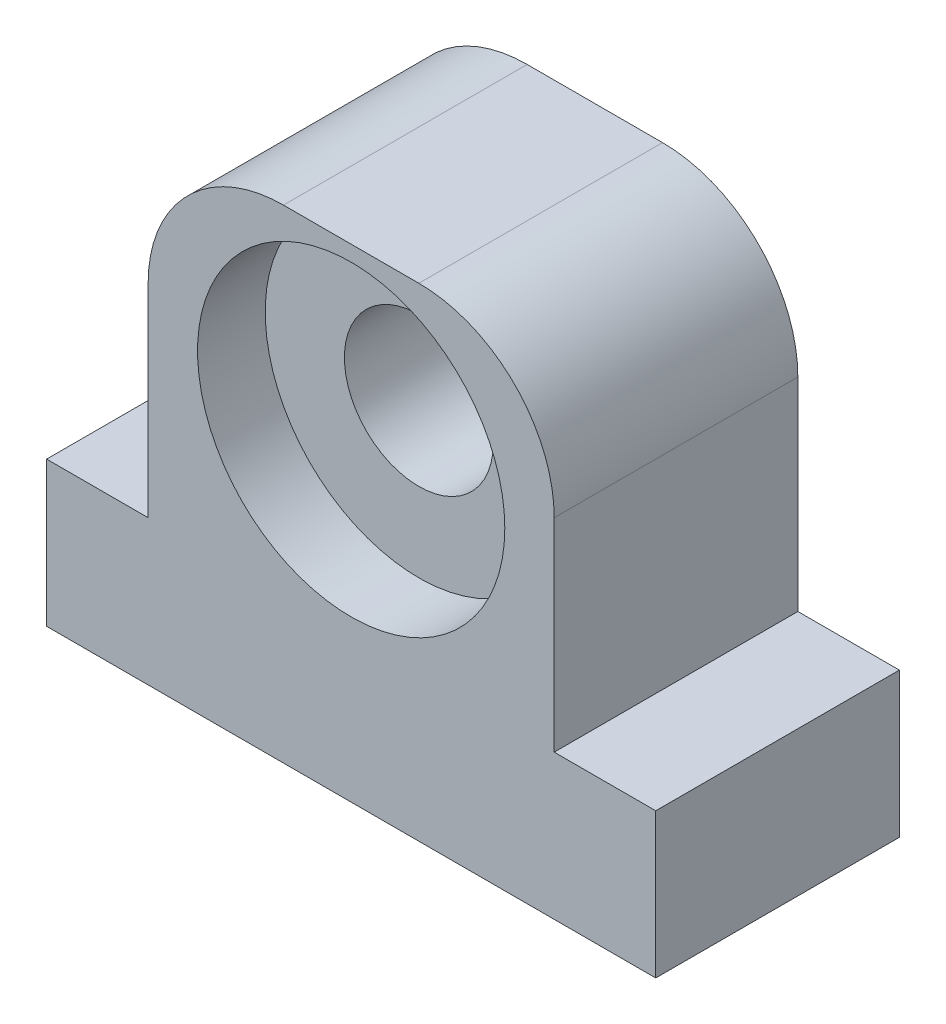
from build123d import *

# Parameters (mm, degrees)
SKETCH1_W           = 45
SKETCH1_H           = 18
BOSS_EXTRUDE1_DEPTH = 3
SKETCH2_W           = 30
SKETCH2_H           = 18
BOSS_EXTRUDE3_DEPTH = 25
SKETCH5_R           = 5.5
CUT_EXTRUDE3_DEPTH  = 25
SKETCH6_R           = 11.35
CUT_EXTRUDE4_DEPTH  = 5
FILLET2_R           = 10
SKETCH7_W           = 45
SKETCH7_H           = 18
BOSS_EXTRUDE4_DEPTH = 4
SKETCH8_W           = 45
SKETCH8_H           = 18
BOSS_EXTRUDE5_DEPTH = 3.7


with BuildPart() as part:
    # Sketch1 → Boss-Extrude1 (new body)
    with BuildSketch(Plane(origin=(0, 0, 0), x_dir=(1, 0, 0), z_dir=(0, 1, 0))):
        Rectangle(SKETCH1_W, SKETCH1_H)
    extrude(amount=BOSS_EXTRUDE1_DEPTH)

    # Sketch2 → Boss-Extrude3 (add)
    with BuildSketch(Plane(origin=(0, 3, 0), x_dir=(1, 0, 0), z_dir=(0, 1, 0))):
        Rectangle(SKETCH2_W, SKETCH2_H)
    extrude(amount=BOSS_EXTRUDE3_DEPTH)

    # Sketch5 → Cut-Extrude3 (cut)
    with BuildSketch(Plane.XY.offset(9)):
        with Locations((0, 15.5)):
            Circle(SKETCH5_R)
    extrude(amount=-CUT_EXTRUDE3_DEPTH, mode=Mode.SUBTRACT)

    # Sketch6 → Cut-Extrude4 (cut)
    with BuildSketch(Plane.XY.offset(9)):
        with Locations((0, 15.5)):
            Circle(SKETCH6_R)
    extrude(amount=-CUT_EXTRUDE4_DEPTH, mode=Mode.SUBTRACT)

    # Fillet2
    fillet2_edges = [part.edges().sort_by_distance(p)[0] for p in [
        (15, 28, 0),
        (-15, 28, 0),
    ]]
    fillet(fillet2_edges, radius=FILLET2_R)

    # Sketch7 → Boss-Extrude4 (add)
    with BuildSketch(Plane.XZ):
        Rectangle(SKETCH7_W, SKETCH7_H)
    extrude(amount=BOSS_EXTRUDE4_DEPTH)

    # Sketch8 → Boss-Extrude5 (add)
    with BuildSketch(Plane.XZ.offset(4)):
        Rectangle(SKETCH8_W, SKETCH8_H)
    extrude(amount=BOSS_EXTRUDE5_DEPTH)


solid = part.part
